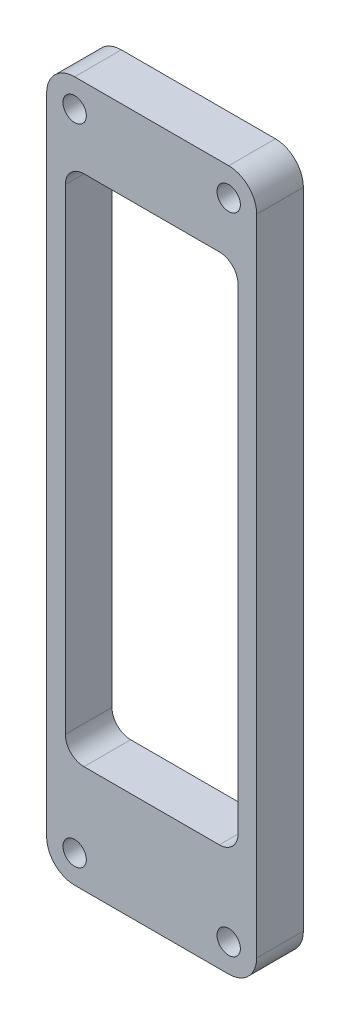
from build123d import *

# Parameters (mm, degrees)
SKETCH1_R           = 2.5
BOSS_EXTRUDE1_DEPTH = 10
CUT_EXTRUDE1_DEPTH  = 10


with BuildPart() as part:
    # Sketch1 → Boss-Extrude1 (new body)
    with BuildSketch(Plane.XY):
        with BuildLine():
            Line((-19.263157895, 110.131578947), (13.736842105, 110.131578947))
            ThreePointArc((13.736842105, 110.131578947), (17.979482792, 108.374219634), (19.736842105, 104.131578947))
            Line((19.736842105, 104.131578947), (19.736842105, -33.868421053))
            ThreePointArc((19.736842105, -33.868421053), (17.979482792, -38.11106174), (13.736842105, -39.868421053))
            Line((13.736842105, -39.868421053), (-19.263157895, -39.868421053))
            ThreePointArc((-19.263157895, -39.868421053), (-23.505798582, -38.11106174), (-25.263157895, -33.868421053))
            Line((-25.263157895, -33.868421053), (-25.263157895, 104.131578947))
            ThreePointArc((-25.263157895, 104.131578947), (-23.505798582, 108.374219634), (-19.263157895, 110.131578947))
        make_face()
        with Locations((-19.263157895, 104.131578947)):
            Circle(SKETCH1_R, mode=Mode.SUBTRACT)
        with Locations((13.736842105, 104.131578947)):
            Circle(SKETCH1_R, mode=Mode.SUBTRACT)
        with Locations((-19.263157895, -33.868421053)):
            Circle(SKETCH1_R, mode=Mode.SUBTRACT)
        with Locations((13.736842105, -33.868421053)):
            Circle(SKETCH1_R, mode=Mode.SUBTRACT)
    extrude(amount=BOSS_EXTRUDE1_DEPTH)

    # Sketch2 → Cut-Extrude1 (cut)
    with BuildSketch(Plane.XY.offset(10)):
        with BuildLine():
            Line((-17.263157895, 93.131578947), (11.736842105, 93.131578947))
            ThreePointArc((11.736842105, 93.131578947), (14.56526923, 91.960006072), (15.736842105, 89.131578947))
            Line((15.736842105, 89.131578947), (15.736842105, -12.868421053))
            ThreePointArc((15.736842105, -12.868421053), (14.56526923, -15.696848177), (11.736842105, -16.868421053))
            Line((11.736842105, -16.868421053), (-17.263157895, -16.868421053))
            ThreePointArc((-17.263157895, -16.868421053), (-20.091585019, -15.696848177), (-21.263157895, -12.868421053))
            Line((-21.263157895, -12.868421053), (-21.263157895, 89.131578947))
            ThreePointArc((-21.263157895, 89.131578947), (-20.091585019, 91.960006072), (-17.263157895, 93.131578947))
        make_face()
    extrude(amount=-CUT_EXTRUDE1_DEPTH, mode=Mode.SUBTRACT)


solid = part.part
